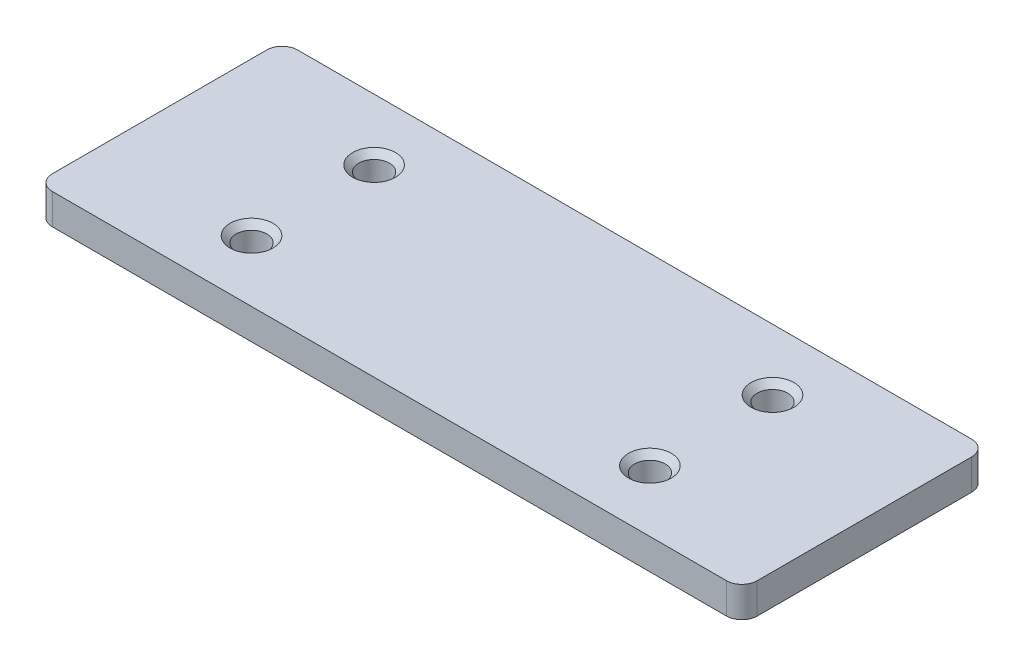
from build123d import *

# Parameters (mm, degrees)
SKETCH1_W           = 115
SKETCH1_H           = 40
SKETCH1_R           = 2.5
BOSS_EXTRUDE1_DEPTH = 5
FILLET1_R           = 2.5
CHAMFER1_SIZE       = 1


with BuildPart() as part:
    # Sketch1 → Boss-Extrude1 (new body)
    with BuildSketch(Plane(origin=(0, 0, 0), x_dir=(1, 0, 0), z_dir=(0, 1, 0))):
        Rectangle(SKETCH1_W, SKETCH1_H)
        with Locations(Location((-32.5, 10, 0), (0, 0, 270))):
            Circle(SKETCH1_R, mode=Mode.SUBTRACT)
        with Locations(Location((-32.5, -10, 0), (0, 0, 270))):
            Circle(SKETCH1_R, mode=Mode.SUBTRACT)
        with Locations(Location((32.5, -10, 0), (0, 0, 90))):
            Circle(SKETCH1_R, mode=Mode.SUBTRACT)
        with Locations(Location((32.5, 10, 0), (0, 0, 90))):
            Circle(SKETCH1_R, mode=Mode.SUBTRACT)
    extrude(amount=BOSS_EXTRUDE1_DEPTH)

    # Fillet1
    fillet1_edges = [part.edges().sort_by_distance(p)[0] for p in [
        (57.5, 2.5, 20),
        (-57.5, 2.5, 20),
        (-57.5, 2.5, -20),
        (57.5, 2.5, -20),
    ]]
    fillet(fillet1_edges, radius=FILLET1_R)

    # Chamfer1
    chamfer1_edges = [part.edges().sort_by_distance(p)[0] for p in [
        (-32.5, 5, -12.5),
        (-32.5, 5, 7.5),
        (32.5, 5, 12.5),
        (32.5, 5, -7.5),
    ]]
    chamfer(chamfer1_edges, length=CHAMFER1_SIZE)


solid = part.part
